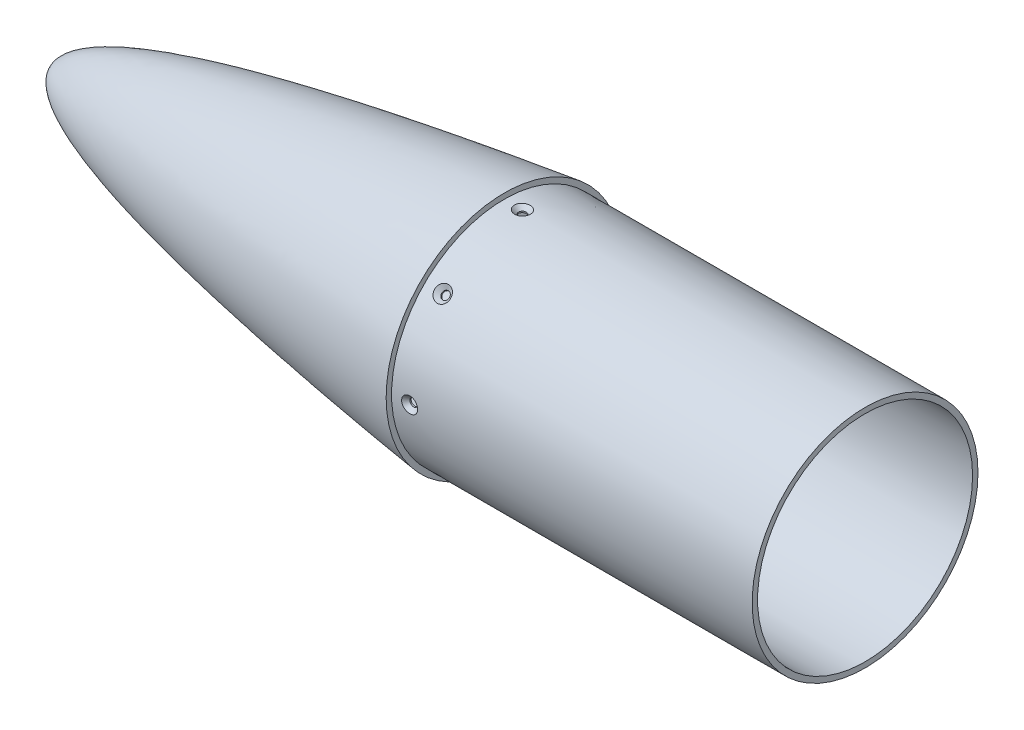
from build123d import *

# Parameters (mm, degrees)
DAIRESEL_KAPLAMA3_COUNT = 8


with BuildPart() as part:
    # Çizim1 → Döndür1 (revolve)
    with BuildSketch(Plane(origin=(0, 0, 0), x_dir=(1, 0, 0), z_dir=(0, 1, 0))):
        with BuildLine():
            Line((250, 65.5), (250, 62.5))
            Line((250, 62.5), (450, 62.5))
            Line((450, 62.5), (450, 59.5))
            Line((450, 59.5), (247, 59.5))
            Line((247, 59.5), (247, 62.079695979))
            add(Edge.make_bspline(
                [(2.999999936, -0.000617724), (3.000091836, 0.44569376), (3.104114028, 1.321022231), (3.736224768, 3.136027216), (5.280577896, 5.413242142), (7.888955108, 7.916658919), (10.915723823, 10.168122003), (14.195190215, 12.206624077), (18.78486002, 14.693888498), (24.794676551, 17.452976635), (32.236370837, 20.380121243), (42.351247744, 23.90464511), (55.230939875, 27.773654329), (70.883322719, 31.859303198), (86.659246449, 35.543915879), (102.518425197, 38.924124297), (123.743353086, 43.10957609), (150.386713788, 47.853863369), (177.11436724, 52.137473512), (195.866889313, 54.953044897), (206.575898895, 56.513148827), (213.288926661, 57.472004938), (218.635913251, 58.225328324), (222.70769092, 58.793195224), (226.655926035, 59.339814309), (230.727709136, 59.897686939), (234.803431095, 60.451281454), (238.073204105, 60.892113494), (240.721139525, 61.246704439), (242.777165903, 61.520697205), (244.922010017, 61.80522493), (246.303261545, 61.987773051), (247, 62.079695979)],
                knots=[0, 0, 0, 0, 0.007034215, 0.014068431, 0.028136862, 0.042205293, 0.056273724, 0.070342155, 0.084410586, 0.112547448, 0.14068431, 0.168821172, 0.225094896, 0.28136862, 0.337642344, 0.393916068, 0.450189792, 0.56273724, 0.675284688, 0.731558411, 0.759695273, 0.787832135, 0.801900566, 0.815968997, 0.830037428, 0.844105859, 0.85817429, 0.872242721, 0.879276937, 0.886311152, 0.893345368, 0.900379583, 0.900379583, 0.900379583, 0.900379583], degree=3))
            Line((2.999999936, -0.000617724), (0, 0))
            add(Edge.make_bspline(
                [(0, 0), (6.4115e-05, 0.311374629), (0.024954834, 0.827028947), (0.12202327, 1.578414863), (0.363776544, 2.566064423), (0.694145155, 3.508977272), (1.173173746, 4.538805985), (1.840262158, 5.671001057), (2.769185372, 6.948015479), (4.081344964, 8.43069534), (5.971582632, 10.196805719), (8.777316309, 12.366669751), (13.025712507, 15.071767101), (19.128895606, 18.253851792), (26.885817958, 21.597967843), (35.87956899, 24.903303647), (47.914781145, 28.786397058), (62.537561829, 32.884116451), (79.774198241, 37.116195703), (97.140855901, 40.892343518), (112.076048373, 43.886621029), (127.042817067, 46.719245407), (139.536720619, 48.960588034), (152.049046295, 51.101176295), (164.57465335, 53.15409506), (174.604851623, 54.748697643), (183.383619967, 56.104982303), (190.918366114, 57.242939397), (197.189613199, 58.173944071), (202.226154499, 58.911893067), (207.227179366, 59.636122008), (212.294541263, 60.360290144), (217.254242762, 61.061909152), (222.389600658, 61.778377521), (228.487213343, 62.621971801), (235.11586399, 63.522405895), (240.858470297, 64.294646871), (246.54015814, 65.045653995), (248.851150932, 65.349500772), (250, 65.5)],
                knots=[0, 0, 0, 0, 0, 0.004302133, 0.007144962, 0.010457253, 0.014049676, 0.018105927, 0.022837732, 0.028614454, 0.035869298, 0.045464276, 0.058584913, 0.077630204, 0.10547608, 0.140607291, 0.175394081, 0.210180871, 0.280443368, 0.350705866, 0.420968365, 0.456099616, 0.491230868, 0.561493369, 0.59662462, 0.631755871, 0.666887122, 0.702018374, 0.719584, 0.737149625, 0.754715251, 0.772280877, 0.789846502, 0.807412128, 0.824977754, 0.842543379, 0.87767463, 0.895240256, 0.912805881, 0.912805881, 0.912805881, 0.912805881, 0.912805881], degree=4))
        make_face()
    revolve(axis=Axis((2.999999936, 0, 0.000617724), (-0.999999978800915, 0, -0.0002059081582836293)))

    # Çizim33 → M4 Altıgen Alyan Havşa Başlı Kör Vida İçin Havşa1 (revolve, cut)
    with BuildSketch(Plane(origin=(260, 62.592657346, 0.04632801), x_dir=(0, 0, 1), z_dir=(1, 0, 0))):
        Polygon((0, 0), (0, 13.591850331), (2.15, 12.3), (2.15, 2.33), (4.48, 0), align=None)
    m4_alt_gen_alyan_hav_a_ba_l_k_r_vida_i = revolve(axis=Axis((260, 68.942657346, 0.04632801), (0, -1, 0)), mode=Mode.SUBTRACT)

    # Dairesel Kaplama3: M4 Altıgen Alyan Havşa Başlı Kör Vida İçin Havşa1 ×8 about axis
    dairesel_kaplama3_axis = Axis((449.987111661, 0, 0.092656019), (0.9999999788009151, 0, 0.00020590815828362935))
    for i in range(1, DAIRESEL_KAPLAMA3_COUNT):
        add(m4_alt_gen_alyan_hav_a_ba_l_k_r_vida_i.rotate(dairesel_kaplama3_axis, i * 360 / DAIRESEL_KAPLAMA3_COUNT), mode=Mode.SUBTRACT)


solid = part.part
